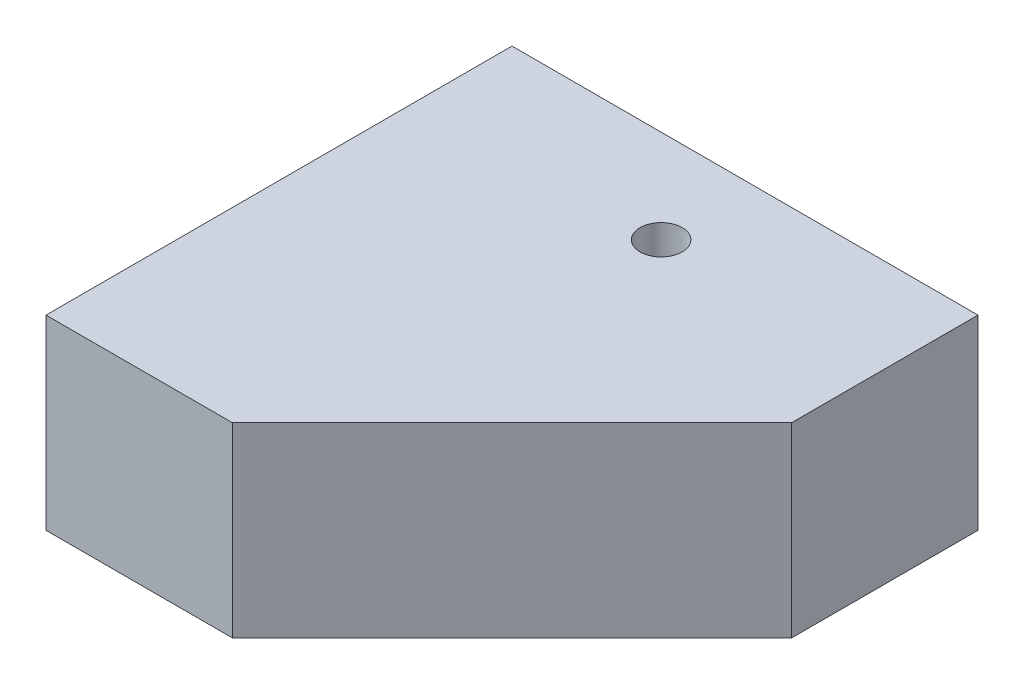
from build123d import *

# Parameters (mm, degrees)
BOSS_EXTRUDE1_DEPTH       = 10
F_4_40_TAPPED_HOLE1_D     = 2.2606
F_4_40_TAPPED_HOLE1_DEPTH = 10
F_4_40_TAPPED_HOLE1_TIP   = 0.679152758
F_4_40_TAPPED_HOLE2_D     = 2.2606
F_4_40_TAPPED_HOLE2_DEPTH = 10
F_4_40_TAPPED_HOLE2_TIP   = 0.679152758
F_4_40_TAPPED_HOLE3_D     = 2.2606
F_4_40_TAPPED_HOLE3_DEPTH = 10
F_4_40_TAPPED_HOLE3_TIP   = 0.679152758


with BuildPart() as part:
    # Sketch1 → Boss-Extrude1 (new body)
    with BuildSketch(Plane(origin=(0, 0, 0), x_dir=(1, 0, 0), z_dir=(0, 1, 0))):
        Polygon((0, 0), (0, 25), (25, 25), (25, 15), (10, 0), align=None)
    extrude(amount=BOSS_EXTRUDE1_DEPTH)

    # #4-40 Tapped Hole1
    with Locations(Plane.ZY):
        with Locations((-15, 5)):
            Hole(F_4_40_TAPPED_HOLE1_D / 2, depth=F_4_40_TAPPED_HOLE1_DEPTH)
            with Locations((0, 0, -(F_4_40_TAPPED_HOLE1_DEPTH + F_4_40_TAPPED_HOLE1_TIP / 2))):  # 118° drill point
                Cone(0, F_4_40_TAPPED_HOLE1_D / 2, F_4_40_TAPPED_HOLE1_TIP, mode=Mode.SUBTRACT)

    # #4-40 Tapped Hole2
    with Locations(Plane(origin=(0, 10, 0), x_dir=(1, 0, 0), z_dir=(0, 1, 0))):
        with Locations((13, 20)):
            Hole(F_4_40_TAPPED_HOLE2_D / 2, depth=F_4_40_TAPPED_HOLE2_DEPTH)
            with Locations((0, 0, -(F_4_40_TAPPED_HOLE2_DEPTH + F_4_40_TAPPED_HOLE2_TIP / 2))):  # 118° drill point
                Cone(0, F_4_40_TAPPED_HOLE2_D / 2, F_4_40_TAPPED_HOLE2_TIP, mode=Mode.SUBTRACT)

    # #4-40 Tapped Hole3
    with Locations(Plane(origin=(0, 0, -25), x_dir=(-1, 0, 0), z_dir=(0, 0, -1))):
        with Locations((-18, 5)):
            Hole(F_4_40_TAPPED_HOLE3_D / 2, depth=F_4_40_TAPPED_HOLE3_DEPTH)
            with Locations((0, 0, -(F_4_40_TAPPED_HOLE3_DEPTH + F_4_40_TAPPED_HOLE3_TIP / 2))):  # 118° drill point
                Cone(0, F_4_40_TAPPED_HOLE3_D / 2, F_4_40_TAPPED_HOLE3_TIP, mode=Mode.SUBTRACT)


solid = part.part
